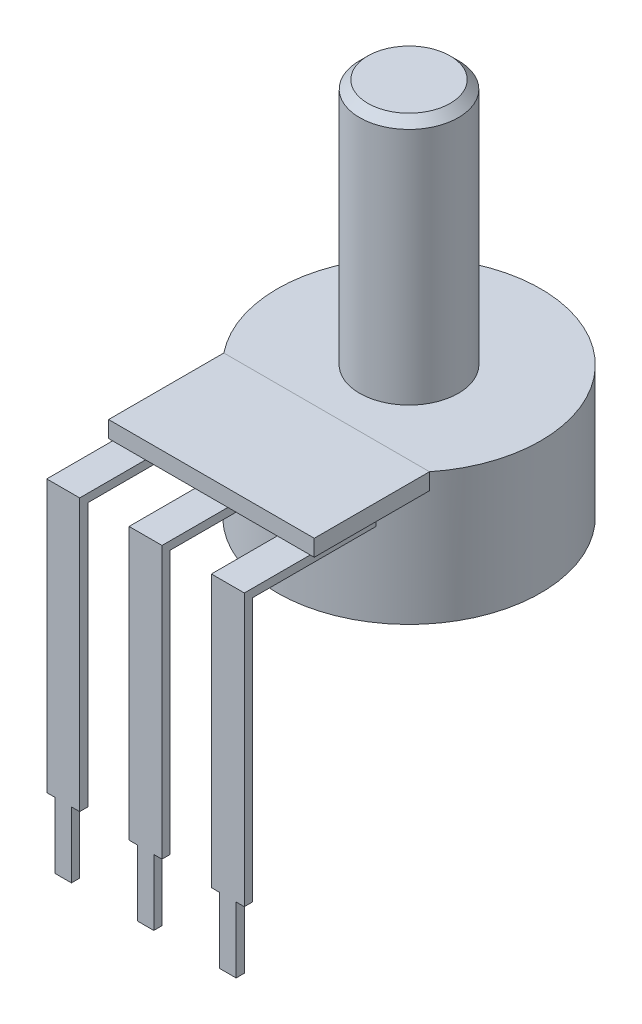
from build123d import *

# Parameters (mm, degrees)
SKETCH1_R             = 8
BOSS_EXTRUDE1_DEPTH   = 8
SKETCH3_R             = 3
BOSS_EXTRUDE2_DEPTH   = 15
CHAMFER1_SIZE         = 0.5
SKETCH2_W             = 19.85892558
SKETCH2_H             = 6
CUT_EXTRUDE2_DEPTH    = 1
SKETCH4_W             = 12.489995996
SKETCH4_H             = 7
BOSS_EXTRUDE3_DEPTH   = 1
SKETCH5_W             = 2
SKETCH5_H             = 8
BOSS_EXTRUDE5_DEPTH   = 0.5
BOSS_EXTRUDE5_2_DEPTH = 0.5
BOSS_EXTRUDE5_3_DEPTH = 0.5
SKETCH6_W             = 2
SKETCH6_H             = 0.5
BOSS_EXTRUDE6_DEPTH   = 16
SKETCH7_W             = 1
SKETCH7_H             = 0.5
BOSS_EXTRUDE7_DEPTH   = 4


with BuildPart() as part:
    # Sketch1 → Boss-Extrude1 (new body)
    with BuildSketch(Plane(origin=(0, 0, 0), x_dir=(1, 0, 0), z_dir=(0, 1, 0))):
        with Locations(Location((0, 0, 0), (0, 0, 270))):
            Circle(SKETCH1_R)
    extrude(amount=-BOSS_EXTRUDE1_DEPTH)

    # Sketch3 → Boss-Extrude2 (add)
    with BuildSketch(Plane(origin=(0, 0, 0), x_dir=(1, 0, 0), z_dir=(0, 1, 0))):
        with Locations(Location((0, 0, 0), (0, 0, 270))):
            Circle(SKETCH3_R)
    extrude(amount=BOSS_EXTRUDE2_DEPTH)

    # Chamfer1
    chamfer1_edges = [part.edges().sort_by_distance(p)[0] for p in [
        (0, 15, -3),
    ]]
    chamfer(chamfer1_edges, length=CHAMFER1_SIZE)

    # Sketch2 → Cut-Extrude2 (cut)
    with BuildSketch(Plane(origin=(0, 0, 0), x_dir=(1, 0, 0), z_dir=(0, 1, 0))):
        with Locations((0, -8)):
            Rectangle(SKETCH2_W, SKETCH2_H)
    extrude(amount=-CUT_EXTRUDE2_DEPTH, mode=Mode.SUBTRACT)


with BuildPart() as body_2:
    # Sketch4 → Boss-Extrude3 (new body)
    with BuildSketch(Plane(origin=(0, -1, 0), x_dir=(1, 0, 0), z_dir=(0, 1, 0))):
        with Locations((0, -8.5)):
            Rectangle(SKETCH4_W, SKETCH4_H)
    extrude(amount=BOSS_EXTRUDE3_DEPTH)


with BuildPart() as body_3:
    # Sketch5 → Boss-Extrude5 (new body)
    with BuildSketch(Plane.XZ.offset(1)):
        with Locations((0, 12)):
            Rectangle(SKETCH5_W, SKETCH5_H)
    extrude(amount=BOSS_EXTRUDE5_DEPTH)



with BuildPart() as body_4:
    # Sketch5 → Boss-Extrude5 2 (new body)
    with BuildSketch(Plane.XZ.offset(1)):
        with Locations((-5, 12)):
            Rectangle(SKETCH5_W, SKETCH5_H)
    extrude(amount=BOSS_EXTRUDE5_2_DEPTH)


with BuildPart() as body_5:
    # Sketch5 → Boss-Extrude5 3 (new body)
    with BuildSketch(Plane.XZ.offset(1)):
        with Locations((5, 12)):
            Rectangle(SKETCH5_W, SKETCH5_H)
    extrude(amount=BOSS_EXTRUDE5_3_DEPTH)


with BuildPart() as body_3_1:
    add(body_3.part)

    add(body_4.part)  # Boss-Extrude6 merges body 4

    add(body_5.part)  # Boss-Extrude6 merges body 5
    # Sketch6 → Boss-Extrude6 (add)
    with BuildSketch(Plane(origin=(0, -1.5, 0), x_dir=(-1, 0, 0), z_dir=(0, -1, 0))):
        with Locations((5, -15.75)):
            Rectangle(SKETCH6_W, SKETCH6_H)
        with Locations((0, -15.75)):
            Rectangle(SKETCH6_W, SKETCH6_H)
        with Locations((-5, -15.75)):
            Rectangle(SKETCH6_W, SKETCH6_H)
    extrude(amount=BOSS_EXTRUDE6_DEPTH)

    # Sketch7 → Boss-Extrude7 (add)
    with BuildSketch(Plane(origin=(0, -17.5, 0), x_dir=(-1, 0, 0), z_dir=(0, -1, 0))):
        with Locations((0, -15.75)):
            Rectangle(SKETCH7_W, SKETCH7_H)
        with Locations((5, -15.75)):
            Rectangle(SKETCH7_W, SKETCH7_H)
        with Locations((-5, -15.75)):
            Rectangle(SKETCH7_W, SKETCH7_H)
    extrude(amount=BOSS_EXTRUDE7_DEPTH)


solid = Compound([part.part, body_2.part, body_3_1.part])
